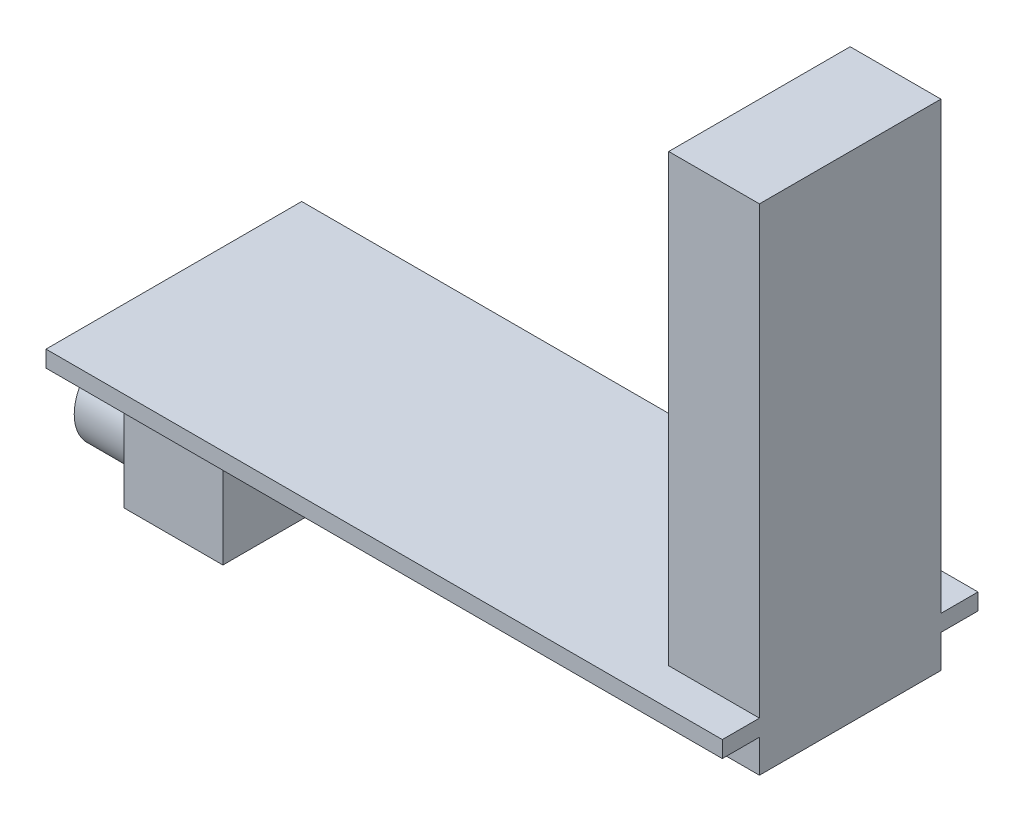
from build123d import *

# Parameters (mm, degrees)
SKETCH_1_W      = 41
SKETCH_1_H      = 15.5
EXTRUDE_1_DEPTH = 1
SKETCH_2_W      = 5.5
SKETCH_2_H      = 11
EXTRUDE_2_DEPTH = 27
SKETCH_3_W      = 5.5
SKETCH_3_H      = 11
EXTRUDE_3_DEPTH = 2
SKETCH_4_W      = 6
SKETCH_4_H      = 6.05
EXTRUDE_4_DEPTH = 9.7
SKETCH_5_R      = 2.64
EXTRUDE_5_DEPTH = 3.4


with BuildPart() as part:
    # 草图1 → 凸台-拉伸1 (new body)
    with BuildSketch(Plane(origin=(0, 0, 0), x_dir=(1, 0, 0), z_dir=(0, 1, 0))):
        Rectangle(SKETCH_1_W, SKETCH_1_H)
    extrude(amount=EXTRUDE_1_DEPTH)

    # 草图2 → 凸台-拉伸2 (add)
    with BuildSketch(Plane(origin=(0, 1, 0), x_dir=(1, 0, 0), z_dir=(0, 1, 0))):
        with Locations((17.75, 0)):
            Rectangle(SKETCH_2_W, SKETCH_2_H)
    extrude(amount=EXTRUDE_2_DEPTH)

    # 草图3 → 凸台-拉伸3 (add)
    with BuildSketch(Plane.XZ):
        with Locations((17.75, 0)):
            Rectangle(SKETCH_3_W, SKETCH_3_H)
    extrude(amount=EXTRUDE_3_DEPTH)

    # 草图4 → 凸台-拉伸4 (add)
    with BuildSketch(Plane.XZ):
        with Locations((-17.5, 0)):
            Rectangle(SKETCH_4_W, SKETCH_4_H)
    extrude(amount=EXTRUDE_4_DEPTH)

    # 草图5 → 凸台-拉伸5 (add)
    with BuildSketch(Plane.ZY.offset(20.5)):
        with Locations(Location((0, -6.679228268, 0), (0, 0, 180))):
            Circle(SKETCH_5_R)
    extrude(amount=EXTRUDE_5_DEPTH)


solid = part.part
